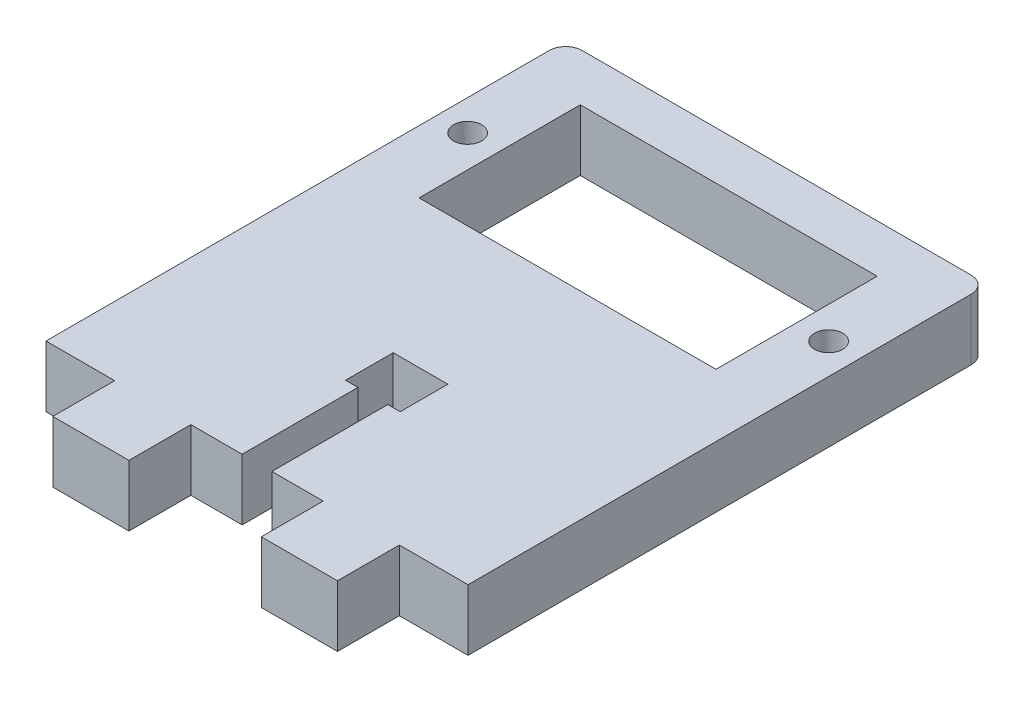
from build123d import *

# Parameters (mm, degrees)
SKETCH1_W           = 32.385
SKETCH1_H           = 39.878
SKETCH1_W_2         = 22.7838
SKETCH1_H_2         = 12.3698
SKETCH1_W_3         = 5.842
SKETCH1_H_3         = 4.7498
BOSS_EXTRUDE1_DEPTH = 4.699
SKETCH2_W           = 1.143
SKETCH2_H           = 8.89
CUT_EXTRUDE1_DEPTH  = 30.896730635
FILLET1_R           = 1.27
SKETCH3_R           = 1.0795
CUT_EXTRUDE2_DEPTH  = 30.896730635


with BuildPart() as part:
    # Sketch1 → Boss-Extrude1 (new body)
    # profile 1 of 3: a face of its own
    with BuildSketch(Plane(origin=(0, 0, 0), x_dir=(1, 0, 0), z_dir=(0, 1, 0))):
        Rectangle(SKETCH1_W, SKETCH1_H)
        with Locations((0, 10.0711)):
            Rectangle(SKETCH1_W_2, SKETCH1_H_2, mode=Mode.SUBTRACT)
    # profile 2 of 3: a face of its own
    with BuildSketch(Plane(origin=(0, 0, 0), x_dir=(1, 0, 0), z_dir=(0, 1, 0))):
        with Locations((-8.001, -22.3139)):
            Rectangle(SKETCH1_W_3, SKETCH1_H_3)
    # profile 3 of 3: a face of its own
    with BuildSketch(Plane(origin=(0, 0, 0), x_dir=(1, 0, 0), z_dir=(0, 1, 0))):
        with Locations((8.001, -22.3139)):
            Rectangle(SKETCH1_W_3, SKETCH1_H_3)
    extrude(amount=BOSS_EXTRUDE1_DEPTH)

    # Sketch2 → Cut-Extrude1 (cut, through all)
    with BuildSketch(Plane(origin=(0, 4.699, 0), x_dir=(1, 0, 0), z_dir=(0, 1, 0))):
        Polygon((-2.0955, -11.049), (-1.143, -11.049), (0, -11.049), (1.143, -11.049), (2.0955, -11.049), (2.0955, -7.3914), (-2.0955, -7.3914), align=None)
        with Locations((0.5715, -15.494)):
            Rectangle(SKETCH2_W, SKETCH2_H)
        with Locations((-0.5715, -15.494)):
            Rectangle(SKETCH2_W, SKETCH2_H)
    extrude(amount=-CUT_EXTRUDE1_DEPTH, mode=Mode.SUBTRACT)

    # Fillet1
    fillet1_edges = [part.edges().sort_by_distance(p)[0] for p in [
        (16.1925, 2.3495, -19.939),
        (-16.1925, 2.3495, -19.939),
    ]]
    fillet(fillet1_edges, radius=FILLET1_R)

    # Sketch3 → Cut-Extrude2 (cut, through all)
    with BuildSketch(Plane(origin=(0, 4.699, 0), x_dir=(1, 0, 0), z_dir=(0, 1, 0))):
        with Locations(Location((13.85062, 10.0711, 0), (0, 0, 270))):
            Circle(SKETCH3_R)
        with Locations(Location((-13.85062, 10.0711, 0), (0, 0, 270))):
            Circle(SKETCH3_R)
    extrude(amount=-CUT_EXTRUDE2_DEPTH, mode=Mode.SUBTRACT)


solid = part.part
